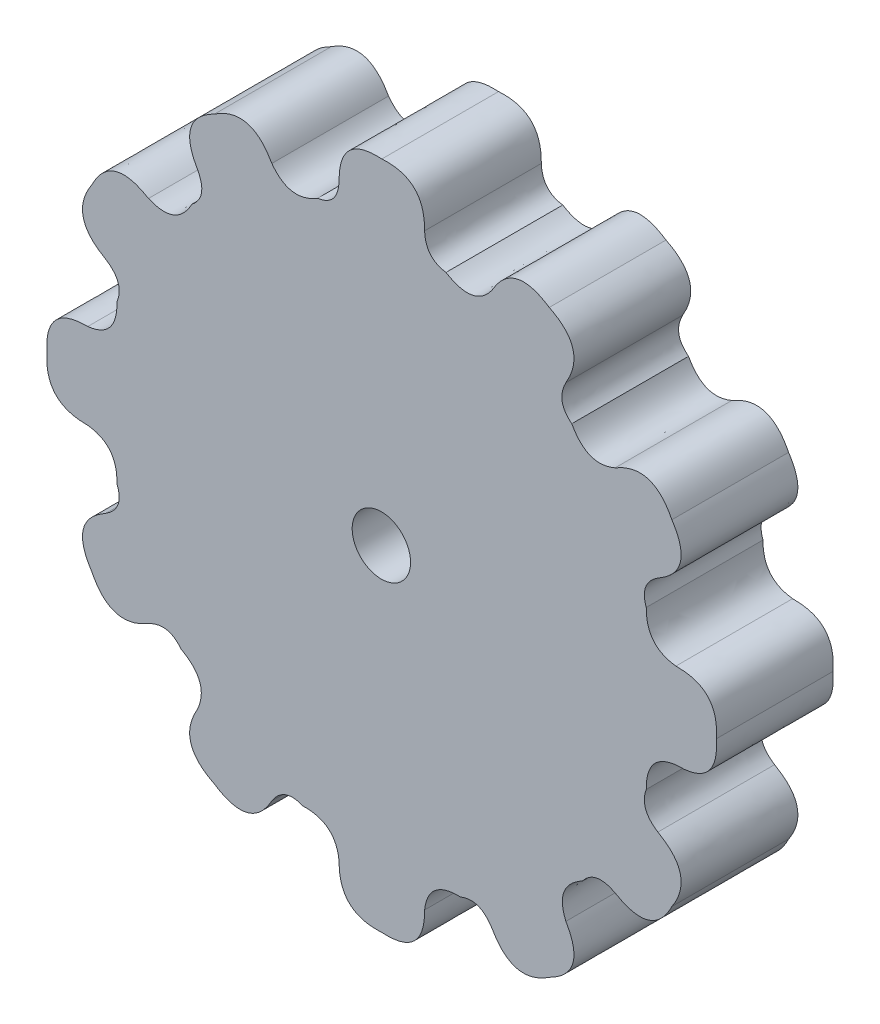
from build123d import *

# Parameters (mm, degrees)
BOSS_EXTRUDE1_DEPTH = 10
SKETCH2_R           = 2.5
CUT_EXTRUDE1_DEPTH  = 10


with BuildPart() as part:
    # Sketch1 → Boss-Extrude1 (new body)
    with BuildSketch(Plane.XY):
        with BuildLine():
            add(Edge.make_bspline(
                [(20.021377374, 15.770240507), (23.228454767, 17.670297014), (24.885304572, 14.345671476)],
                knots=[0, 0, 0, 1, 1, 1], degree=2))
            add(Edge.make_bspline(
                [(23.687053943, 9.421102444), (26.936089844, 11.248484685), (24.885304572, 14.345671476)],
                knots=[0, 0, 0, 1, 1, 1], degree=2))
            add(Edge.make_bspline(
                [(23.687053943, 9.421102444), (22.092796181, 8.40320107), (22.691342951, 6.75)],
                knots=[0, 0, 0, 1, 1, 1], degree=2))
            add(Edge.make_bspline(
                [(25.229215659, 3.66567657), (22.664233629, 3.966024086), (22.691342951, 6.75)],
                knots=[0, 0, 0, 1, 1, 1], degree=2))
            add(Edge.make_bspline(
                [(25.229215659, 3.66567657), (28.97000579, 3.713913663), (28.691342951, 0)],
                knots=[0, 0, 0, 1, 1, 1], degree=2))
            add(Edge.make_bspline(
                [(25.229215659, -3.66567657), (28.97000579, -3.713913663), (28.691342951, 0)],
                knots=[0, 0, 0, 1, 1, 1], degree=2))
            add(Edge.make_bspline(
                [(25.229215659, -3.66567657), (22.664233629, -3.966024086), (22.691342951, -6.75)],
                knots=[0, 0, 0, 1, 1, 1], degree=2))
            add(Edge.make_bspline(
                [(23.687053943, -9.421102444), (22.092796181, -8.40320107), (22.691342951, -6.75)],
                knots=[0, 0, 0, 1, 1, 1], degree=2))
            add(Edge.make_bspline(
                [(23.687053943, -9.421102444), (26.936089844, -11.248484685), (24.885304572, -14.345671476)],
                knots=[0, 0, 0, 1, 1, 1], degree=2))
            add(Edge.make_bspline(
                [(20.021377374, -15.770240507), (23.228454767, -17.670297014), (24.885304572, -14.345671476)],
                knots=[0, 0, 0, 1, 1, 1], degree=2))
            add(Edge.make_bspline(
                [(20.021377374, -15.770240507), (18.324240092, -14.876219604), (17.229215659, -16.276279442)],
                knots=[0, 0, 0, 1, 1, 1], degree=2))
            add(Edge.make_bspline(
                [(15.808113214, -19.983504666), (14.776936626, -17.60976644), (17.229215659, -16.276279442)],
                knots=[0, 0, 0, 1, 1, 1], degree=2))
            add(Edge.make_bspline(
                [(15.808113214, -19.983504666), (17.708169721, -23.19058206), (14.383544183, -24.847431864)],
                knots=[0, 0, 0, 1, 1, 1], degree=2))
            add(Edge.make_bspline(
                [(9.458975152, -23.649181236), (11.286357393, -26.898217136), (14.383544183, -24.847431864)],
                knots=[0, 0, 0, 1, 1, 1], degree=2))
            add(Edge.make_bspline(
                [(9.458975152, -23.649181236), (8.436221603, -22.026367781), (6.787872708, -22.691342951)],
                knots=[0, 0, 0, 1, 1, 1], degree=2))
            add(Edge.make_bspline(
                [(3.703549277, -25.191342951), (3.997393269, -22.620037051), (6.787872708, -22.691342951)],
                knots=[0, 0, 0, 1, 1, 1], degree=2))
            add(Edge.make_bspline(
                [(3.703549277, -25.191342951), (3.745507784, -28.918781699), (0.037872708, -28.691342951)],
                knots=[0, 0, 0, 1, 1, 1], degree=2))
            add(Edge.make_bspline(
                [(-3.627803862, -25.191342951), (-3.669762369, -28.918781699), (0.037872708, -28.691342951)],
                knots=[0, 0, 0, 1, 1, 1], degree=2))
            add(Edge.make_bspline(
                [(-3.627803862, -25.191342951), (-3.921647854, -22.620037051), (-6.712127292, -22.691342951)],
                knots=[0, 0, 0, 1, 1, 1], degree=2))
            add(Edge.make_bspline(
                [(-9.383229737, -23.649181236), (-8.360476188, -22.026367781), (-6.712127292, -22.691342951)],
                knots=[0, 0, 0, 1, 1, 1], degree=2))
            add(Edge.make_bspline(
                [(-9.383229737, -23.649181236), (-11.210611978, -26.898217136), (-14.307798768, -24.847431864)],
                knots=[0, 0, 0, 1, 1, 1], degree=2))
            add(Edge.make_bspline(
                [(-15.732367799, -19.983504666), (-17.632424306, -23.19058206), (-14.307798768, -24.847431864)],
                knots=[0, 0, 0, 1, 1, 1], degree=2))
            add(Edge.make_bspline(
                [(-15.732367799, -19.983504666), (-14.701191211, -17.60976644), (-17.153470244, -16.276279442)],
                knots=[0, 0, 0, 1, 1, 1], degree=2))
            add(Edge.make_bspline(
                [(-19.945631959, -15.770240507), (-18.248494677, -14.876219604), (-17.153470244, -16.276279442)],
                knots=[0, 0, 0, 1, 1, 1], degree=2))
            add(Edge.make_bspline(
                [(-19.945631959, -15.770240507), (-23.152709352, -17.670297014), (-24.809559157, -14.345671476)],
                knots=[0, 0, 0, 1, 1, 1], degree=2))
            add(Edge.make_bspline(
                [(-23.611308528, -9.421102444), (-26.860344428, -11.248484685), (-24.809559157, -14.345671476)],
                knots=[0, 0, 0, 1, 1, 1], degree=2))
            add(Edge.make_bspline(
                [(-23.611308528, -9.421102444), (-21.988495074, -8.398348896), (-22.653470244, -6.75)],
                knots=[0, 0, 0, 1, 1, 1], degree=2))
            add(Edge.make_bspline(
                [(-25.153470244, -3.66567657), (-22.582164343, -3.959520562), (-22.653470244, -6.75)],
                knots=[0, 0, 0, 1, 1, 1], degree=2))
            add(Edge.make_bspline(
                [(-25.153470244, -3.66567657), (-28.880908991, -3.707635076), (-28.653470244, 0)],
                knots=[0, 0, 0, 1, 1, 1], degree=2))
            add(Edge.make_bspline(
                [(-25.153470244, 3.66567657), (-28.880908991, 3.707635076), (-28.653470244, 0)],
                knots=[0, 0, 0, 1, 1, 1], degree=2))
            add(Edge.make_bspline(
                [(-25.153470244, 3.66567657), (-22.582164343, 3.959520562), (-22.653470244, 6.75)],
                knots=[0, 0, 0, 1, 1, 1], degree=2))
            add(Edge.make_bspline(
                [(-23.611308528, 9.421102444), (-21.988495074, 8.398348896), (-22.653470244, 6.75)],
                knots=[0, 0, 0, 1, 1, 1], degree=2))
            add(Edge.make_bspline(
                [(-23.611308528, 9.421102444), (-26.860344428, 11.248484685), (-24.809559157, 14.345671476)],
                knots=[0, 0, 0, 1, 1, 1], degree=2))
            add(Edge.make_bspline(
                [(-19.945631959, 15.770240507), (-23.152709352, 17.670297014), (-24.809559157, 14.345671476)],
                knots=[0, 0, 0, 1, 1, 1], degree=2))
            add(Edge.make_bspline(
                [(-19.945631959, 15.770240507), (-17.571893732, 14.739063919), (-16.238406734, 17.191342951)],
                knots=[0, 0, 0, 1, 1, 1], degree=2))
            add(Edge.make_bspline(
                [(-15.732367799, 19.983504666), (-14.838346896, 18.286367384), (-16.238406734, 17.191342951)],
                knots=[0, 0, 0, 1, 1, 1], degree=2))
            add(Edge.make_bspline(
                [(-15.732367799, 19.983504666), (-17.632424306, 23.19058206), (-14.307798768, 24.847431864)],
                knots=[0, 0, 0, 1, 1, 1], degree=2))
            add(Edge.make_bspline(
                [(-9.383229737, 23.649181236), (-11.210611978, 26.898217136), (-14.307798768, 24.847431864)],
                knots=[0, 0, 0, 1, 1, 1], degree=2))
            add(Edge.make_bspline(
                [(-9.383229737, 23.649181236), (-7.843100425, 21.569287002), (-5.462127292, 23.026279442)],
                knots=[0, 0, 0, 1, 1, 1], degree=2))
            add(Edge.make_bspline(
                [(-3.627803862, 25.191342951), (-3.70212769, 23.2745685), (-5.462127292, 23.026279442)],
                knots=[0, 0, 0, 1, 1, 1], degree=2))
            add(Edge.make_bspline(
                [(-3.627803862, 25.191342951), (-3.669762369, 28.918781699), (0.037872708, 28.691342951)],
                knots=[0, 0, 0, 1, 1, 1], degree=2))
            add(Edge.make_bspline(
                [(3.703549277, 25.191342951), (3.745507784, 28.918781699), (0.037872708, 28.691342951)],
                knots=[0, 0, 0, 1, 1, 1], degree=2))
            add(Edge.make_bspline(
                [(3.703549277, 25.191342951), (3.777873105, 23.2745685), (5.537872708, 23.026279442)],
                knots=[0, 0, 0, 1, 1, 1], degree=2))
            add(Edge.make_bspline(
                [(9.458975152, 23.649181236), (7.91884584, 21.569287002), (5.537872708, 23.026279442)],
                knots=[0, 0, 0, 1, 1, 1], degree=2))
            add(Edge.make_bspline(
                [(9.458975152, 23.649181236), (11.286357393, 26.898217136), (14.383544183, 24.847431864)],
                knots=[0, 0, 0, 1, 1, 1], degree=2))
            add(Edge.make_bspline(
                [(15.808113214, 19.983504666), (17.708169721, 23.19058206), (14.383544183, 24.847431864)],
                knots=[0, 0, 0, 1, 1, 1], degree=2))
            add(Edge.make_bspline(
                [(15.808113214, 19.983504666), (14.914092312, 18.286367384), (16.314152149, 17.191342951)],
                knots=[0, 0, 0, 1, 1, 1], degree=2))
            add(Edge.make_bspline(
                [(20.021377374, 15.770240507), (17.647639148, 14.739063919), (16.314152149, 17.191342951)],
                knots=[0, 0, 0, 1, 1, 1], degree=2))
        make_face()
    extrude(amount=BOSS_EXTRUDE1_DEPTH)

    # Sketch2 → Cut-Extrude1 (cut)
    with BuildSketch(Plane.XY.offset(10)):
        Circle(SKETCH2_R)
    extrude(amount=-CUT_EXTRUDE1_DEPTH, mode=Mode.SUBTRACT)


solid = part.part
